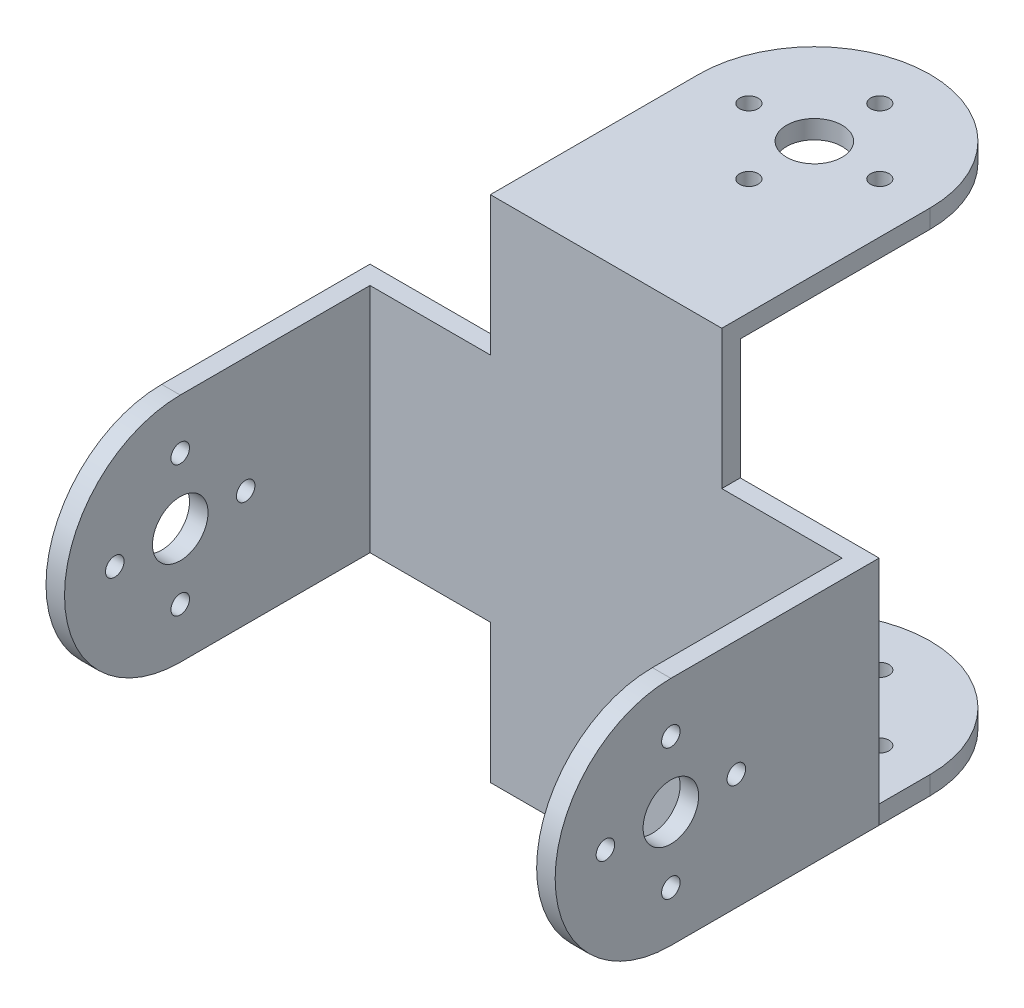
from build123d import *

# Parameters (mm, degrees)
SKETCH_1_W          = 25
SKETCH_1_H          = 15
EXTRUDE_2_DEPTH     = 2
SKETCH_3_W          = 2
SKETCH_3_H          = 25
EXTRUDE_3_DEPTH     = 33
SKETCH_4_W          = 25
SKETCH_4_H          = 2
EXTRUDE_4_DEPTH     = 33
SKETCH_5_R          = 1
CUT_EXTRUDE_2_DEPTH = 71.75485849
SKETCH_6_R          = 1
CUT_EXTRUDE_3_DEPTH = 71.75485849
SKETCH_7_R          = 3
CUT_EXTRUDE_4_DEPTH = 71.75485849
SKETCH_8_R          = 3
CUT_EXTRUDE_5_DEPTH = 71.75485849
SKETCH_9_R          = 12.5
SKETCH_9_R_2        = 3
EXTRUDE_5_DEPTH     = 2
SKETCH_10_R         = 12.5
SKETCH_10_R_2       = 3
EXTRUDE_6_DEPTH     = 2
SKETCH_11_R         = 1
CUT_EXTRUDE_6_DEPTH = 71.75485849
SKETCH_12_R         = 12.5
SKETCH_12_R_2       = 3
EXTRUDE_7_DEPTH     = 2
EXTRUDE_START       = -2
SKETCH_13_R         = 12.5
SKETCH_13_R_2       = 3
EXTRUDE_8_DEPTH     = 2
SKETCH_14_R         = 1
CUT_EXTRUDE_7_DEPTH = 71.75485849


with BuildPart() as part:
    # 草图1 → 凸台-拉伸2 (new body)
    with BuildSketch(Plane.XY):
        Polygon((-12.5, 12.5), (-27.5, 12.5), (-27.5, -12.5), (-12.5, -12.5), (12.5, -12.5), (27.5, -12.5), (27.5, 12.5), (12.5, 12.5), align=None)
        with Locations((0, 20)):
            Rectangle(SKETCH_1_W, SKETCH_1_H)
        with Locations((0, -20)):
            Rectangle(SKETCH_1_W, SKETCH_1_H)
    extrude(amount=EXTRUDE_2_DEPTH)

    # 草图3 → 凸台-拉伸3 (add)
    with BuildSketch(Plane.XY.offset(2)):
        with Locations((26.5, 0)):
            Rectangle(SKETCH_3_W, SKETCH_3_H)
        with Locations((-26.5, 0)):
            Rectangle(SKETCH_3_W, SKETCH_3_H)
    extrude(amount=EXTRUDE_3_DEPTH)

    # 草图4 → 凸台-拉伸4 (add)
    with BuildSketch(Plane(origin=(0, 0, 0), x_dir=(-1, 0, 0), z_dir=(0, 0, -1))):
        with Locations((0, 26.5)):
            Rectangle(SKETCH_4_W, SKETCH_4_H)
        with Locations((0, -26.5)):
            Rectangle(SKETCH_4_W, SKETCH_4_H)
    extrude(amount=EXTRUDE_4_DEPTH)

    # 草图5 → 切除-拉伸2 (cut, through all)
    with BuildSketch(Plane.ZY.offset(27.5)):
        with BuildLine():
            Line((35, 12.5), (22.5, 12.5))
            ThreePointArc((22.5, 12.5), (31.338834765, 8.838834765), (35, 0))
            Line((35, 0), (35, 12.5))
        make_face()
        with BuildLine():
            Line((35, -12.5), (35, 0))
            ThreePointArc((35, 0), (31.338834765, -8.838834765), (22.5, -12.5))
            Line((22.5, -12.5), (35, -12.5))
        make_face()
        with Locations((29.682514636, 0)):
            Circle(SKETCH_5_R)
        with Locations((22.5, 6.957836122)):
            Circle(SKETCH_5_R)
        with Locations((15.317485364, 0)):
            Circle(SKETCH_5_R)
        with Locations((22.5, -6.957836122)):
            Circle(SKETCH_5_R)
    extrude(amount=-CUT_EXTRUDE_2_DEPTH, mode=Mode.SUBTRACT)

    # 草图6 → 切除-拉伸3 (cut, through all)
    with BuildSketch(Plane(origin=(0, 27.5, 0), x_dir=(1, 0, 0), z_dir=(0, 1, 0))):
        with BuildLine():
            Line((-12.5, 33), (-12.5, 20.5))
            ThreePointArc((-12.5, 20.5), (-8.838834765, 29.338834765), (0, 33))
            Line((0, 33), (-12.5, 33))
        make_face()
        with BuildLine():
            ThreePointArc((0, 33), (8.838834765, 29.338834765), (12.5, 20.5))
            Line((12.5, 20.5), (12.5, 33))
            Line((12.5, 33), (0, 33))
        make_face()
        with Locations(Location((6.473248516, 20.5, 0), (0, 0, 270))):
            Circle(SKETCH_6_R)
        with Locations(Location((0, 28.122142327, 0), (0, 0, 270))):
            Circle(SKETCH_6_R)
        with Locations(Location((-6.473248516, 20.5, 0), (0, 0, 270))):
            Circle(SKETCH_6_R)
        with Locations(Location((0, 12.877857673, 0), (0, 0, 270))):
            Circle(SKETCH_6_R)
    extrude(amount=-CUT_EXTRUDE_3_DEPTH, mode=Mode.SUBTRACT)

    # 草图7 → 切除-拉伸4 (cut, through all)
    with BuildSketch(Plane(origin=(0, 27.5, 0), x_dir=(1, 0, 0), z_dir=(0, 1, 0))):
        with Locations(Location((0, 20.5, 0), (0, 0, 270))):
            Circle(SKETCH_7_R)
    extrude(amount=-CUT_EXTRUDE_4_DEPTH, mode=Mode.SUBTRACT)

    # 草图8 → 切除-拉伸5 (cut, through all)
    with BuildSketch(Plane(origin=(27.5, 0, 0), x_dir=(0, 0, -1), z_dir=(1, 0, 0))):
        with Locations((-22.5, 0)):
            Circle(SKETCH_8_R)
    extrude(amount=-CUT_EXTRUDE_5_DEPTH, mode=Mode.SUBTRACT)

    # 草图9 → 凸台-拉伸5 (add)
    with BuildSketch(Plane(origin=(27.5, 0, 0), x_dir=(0, 0, -1), z_dir=(1, 0, 0))):
        with Locations((-22.5, 0)):
            Circle(SKETCH_9_R)
        with Locations((-22.5, 0)):
            Circle(SKETCH_9_R_2, mode=Mode.SUBTRACT)
    extrude(amount=-EXTRUDE_5_DEPTH)

    # 草图10 → 凸台-拉伸6 (add)
    with BuildSketch(Plane.ZY.offset(27.5)):
        with Locations((22.5, 0)):
            Circle(SKETCH_10_R)
        with Locations(Location((22.5, 0, 0), (0, 0, 180))):
            Circle(SKETCH_10_R_2, mode=Mode.SUBTRACT)
    extrude(amount=-EXTRUDE_6_DEPTH)

    # 草图11 → 切除-拉伸6 (cut, through all)
    with BuildSketch(Plane.ZY.offset(27.5)):
        with Locations((22.5, 7.071067812)):
            Circle(SKETCH_11_R)
        with Locations((29.571067812, 0)):
            Circle(SKETCH_11_R)
        with Locations(Location((22.5, -7.071067812, 0), (0, 0, 90))):
            Circle(SKETCH_11_R)
        with Locations(Location((15.428932188, 0, 0), (0, 0, 90))):
            Circle(SKETCH_11_R)
    extrude(amount=-CUT_EXTRUDE_6_DEPTH, mode=Mode.SUBTRACT)

    # 草图12 → 凸台-拉伸7 (add)
    with BuildSketch(Plane(origin=(0, 27.5, 0), x_dir=(1, 0, 0), z_dir=(0, 1, 0))):
        with Locations((0, 20.5)):
            Circle(SKETCH_12_R)
        with Locations(Location((0, 20.5, 0), (0, 0, 270))):
            Circle(SKETCH_12_R_2, mode=Mode.SUBTRACT)
    extrude(amount=-EXTRUDE_7_DEPTH)

    # 草图13 → 凸台-拉伸8 (add)
    with BuildSketch(Plane.XZ.offset(27.5).offset(EXTRUDE_START)):
        with Locations((0, -20.5)):
            Circle(SKETCH_13_R)
        with Locations(Location((0, -20.5, 0), (0, 0, 90))):
            Circle(SKETCH_13_R_2, mode=Mode.SUBTRACT)
    extrude(amount=EXTRUDE_8_DEPTH)

    # 草图14 → 切除-拉伸7 (cut, through all)
    with BuildSketch(Plane(origin=(0, -27.5, 0), x_dir=(-1, 0, 0), z_dir=(0, -1, 0))):
        with Locations(Location((0, 13.428932188, 0), (0, 0, 90))):
            Circle(SKETCH_14_R)
        with Locations(Location((-7.071067812, 20.5, 0), (0, 0, 90))):
            Circle(SKETCH_14_R)
        with Locations(Location((0, 27.571067812, 0), (0, 0, 90))):
            Circle(SKETCH_14_R)
        with Locations(Location((7.071067812, 20.5, 0), (0, 0, 90))):
            Circle(SKETCH_14_R)
    extrude(amount=-CUT_EXTRUDE_7_DEPTH, mode=Mode.SUBTRACT)


solid = part.part
